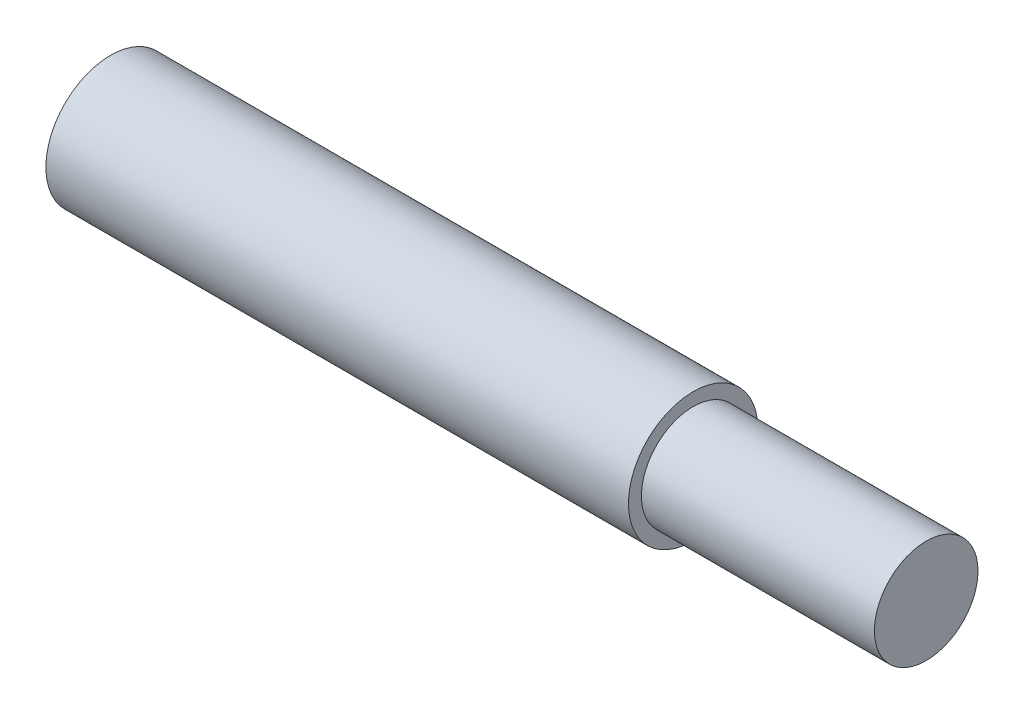
from build123d import *

# Parameters (mm, degrees)
SKETCH1_R           = 2.54
BOSS_EXTRUDE1_DEPTH = 11.43
SKETCH1_3_R         = 3.175
BOSS_EXTRUDE2_DEPTH = 28.575


with BuildPart() as part:
    # Sketch1 → Boss-Extrude1 (new body)
    with BuildSketch(Plane(origin=(0, 0, 0), x_dir=(0, 0, -1), z_dir=(1, 0, 0))):
        Circle(SKETCH1_R)
    extrude(amount=BOSS_EXTRUDE1_DEPTH)

    # Sketch1<3> → Boss-Extrude2 (add)
    with BuildSketch(Plane(origin=(0, 0, 0), x_dir=(0, 0, -1), z_dir=(1, 0, 0))):
        Circle(SKETCH1_3_R)
    extrude(amount=-BOSS_EXTRUDE2_DEPTH)


solid = part.part
